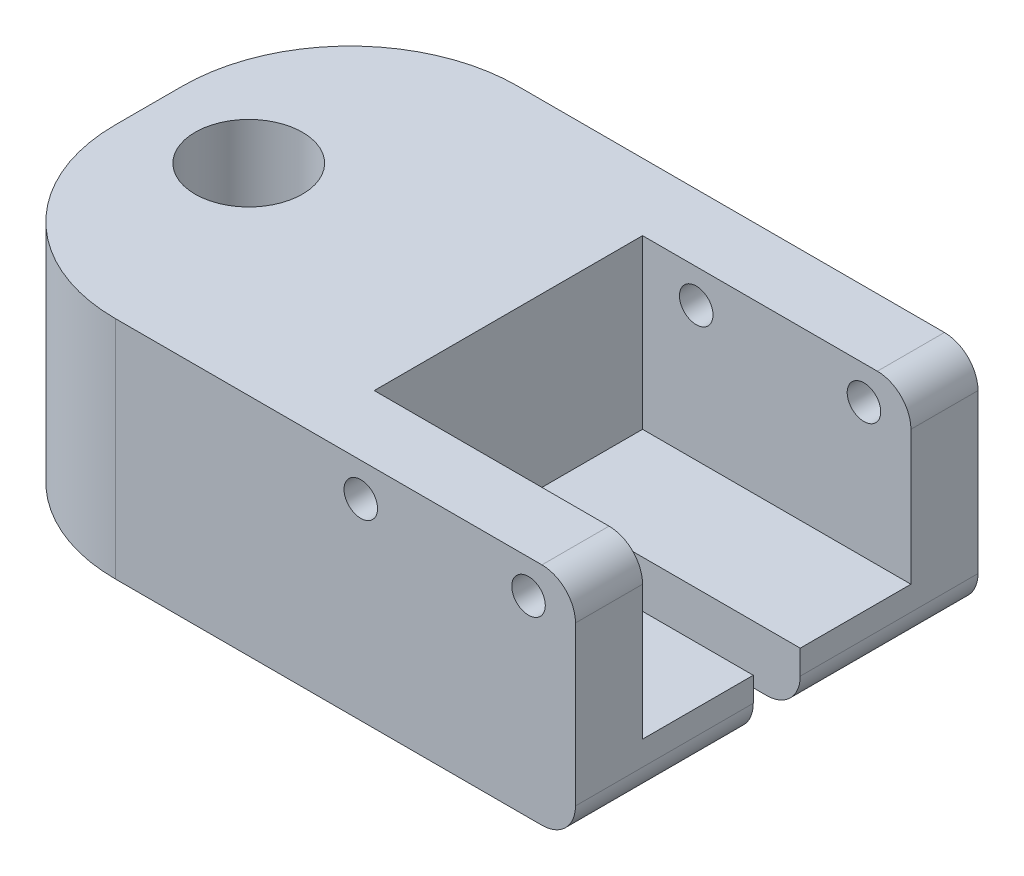
from build123d import *

# Parameters (mm, degrees)
SKETCH1_W                  = 93.6
SKETCH1_H                  = 33.62
BOSS_EXTRUDE2_DEPTH        = 60
CUT_EXTRUDE2_DEPTH         = 40
FILLET2_R                  = 25
F_16_0_16_DIAMETER_HOLE2_D = 16
FILLET3_R                  = 5
SKETCH13_W                 = 40
SKETCH13_H                 = 7
CUT_EXTRUDE3_DEPTH         = 103.58979849
F_5_0_5_DIAMETER_HOLE1_D   = 5


with BuildPart() as part:
    # Sketch1 → Boss-Extrude2 (new body)
    with BuildSketch(Plane.XY):
        with Locations((32.570440053, 16.81)):
            Rectangle(SKETCH1_W, SKETCH1_H)
    extrude(amount=BOSS_EXTRUDE2_DEPTH)

    # Sketch8 → Cut-Extrude2 (cut)
    with BuildSketch(Plane(origin=(79.370440053, 0, 0), x_dir=(0, 0, -1), z_dir=(1, 0, 0))):
        Polygon((-30, 8.62), (-10, 8.62), (-10, 33.62), (-50, 33.62), (-50, 8.62), align=None)
    extrude(amount=-CUT_EXTRUDE2_DEPTH, mode=Mode.SUBTRACT)

    # Fillet2
    fillet2_edges = [part.edges().sort_by_distance(p)[0] for p in [
        (-14.229559947, 16.81, 60),
        (-14.229559947, 16.81, 0),
    ]]
    fillet(fillet2_edges, radius=FILLET2_R)

    # Ø16.0 (16) Diameter Hole2 (through all)
    with Locations(Plane(origin=(0.670440053, 33.62, 30), x_dir=(1, 0, 0), z_dir=(0, 1, 0))):
        with Locations((0, 0)):
            Hole(F_16_0_16_DIAMETER_HOLE2_D / 2)

    # Fillet3
    fillet3_edges = [part.edges().sort_by_distance(p)[0] for p in [
        (79.370440053, 33.62, 5),
        (79.370440053, 33.62, 55),
        (79.370440053, 0, 30),
    ]]
    fillet(fillet3_edges, radius=FILLET3_R)

    # Sketch13 → Cut-Extrude3 (cut, through all)
    with BuildSketch(Plane(origin=(0, 8.62, 0), x_dir=(1, 0, 0), z_dir=(0, 1, 0))):
        with Locations((59.370440053, -30)):
            Rectangle(SKETCH13_W, SKETCH13_H)
    extrude(amount=-CUT_EXTRUDE3_DEPTH, mode=Mode.SUBTRACT)

    # Ø5.0 (5) Diameter Hole1 (through all)
    with Locations(Plane(origin=(72.370440053, 28.62, 60), x_dir=(1, 0, 0), z_dir=(0, 0, 1))):
        with Locations((0, 0), (-25, 0)):
            Hole(F_5_0_5_DIAMETER_HOLE1_D / 2)


solid = part.part
